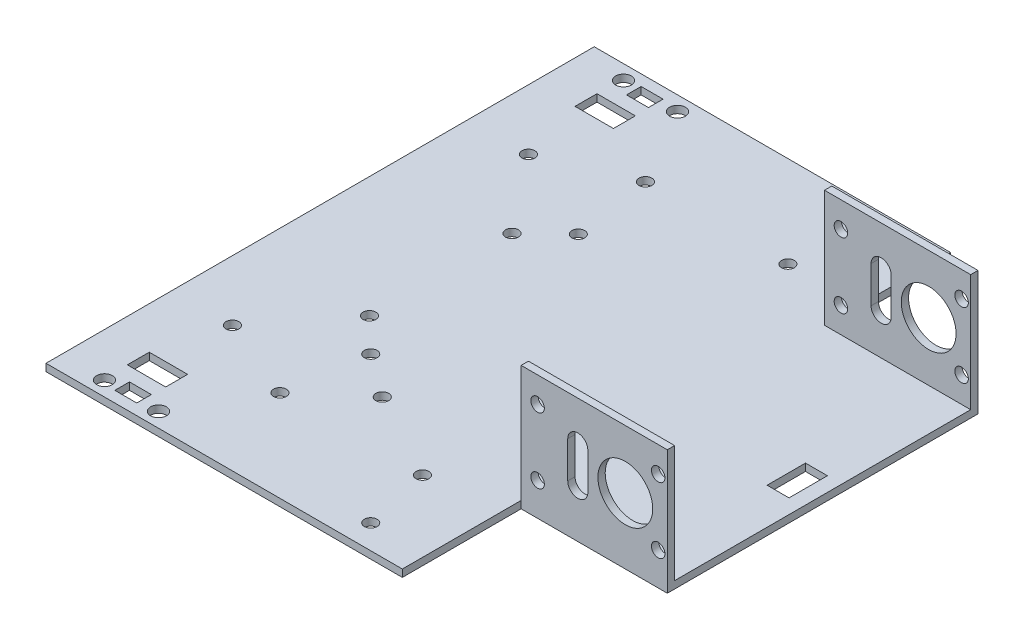
from build123d import *

# Parameters (mm, degrees)
SKETCH1_R           = 2.15
SKETCH1_R_2         = 1.75
SKETCH1_W           = 10.5
SKETCH1_H           = 6
SKETCH1_W_2         = 6
SKETCH1_H_2         = 4
SKETCH1_H_3         = 10.5
BOSS_EXTRUDE1_DEPTH = 2
SKETCH2_W           = 40
SKETCH2_H           = 2
BOSS_EXTRUDE2_DEPTH = 34
SKETCH4_R           = 1.85
SKETCH4_R_2         = 7.5
CUT_EXTRUDE2_DEPTH  = 120
SKETCH5_W           = 4.5
SKETCH5_H           = 32.5
CUT_EXTRUDE3_DEPTH  = 120


with BuildPart() as part:
    # Sketch1 → Boss-Extrude1 (new body)
    with BuildSketch(Plane(origin=(0, 0, 0), x_dir=(1, 0, 0), z_dir=(0, 1, 0))):
        Polygon((-68.75, -75), (33.25, -75), (33.25, -42.5), (68.75, -42.5), (68.75, 42.5), (33.25, 42.5), (33.25, 75), (-68.75, 75), align=None)
        with Locations(Location((-56.75, -71, 0), (0, 0, 270))):
            Circle(SKETCH1_R, mode=Mode.SUBTRACT)
        with Locations(Location((-41.97, -71, 0), (0, 0, 270))):
            Circle(SKETCH1_R, mode=Mode.SUBTRACT)
        with Locations(Location((-52.25, -40.5, 0), (0, 0, 270))):
            Circle(SKETCH1_R_2, mode=Mode.SUBTRACT)
        with Locations(Location((-29.75, -50, 0), (0, 0, 270))):
            Circle(SKETCH1_R_2, mode=Mode.SUBTRACT)
        with Locations(Location((-35.75, -19.5, 0), (0, 0, 270))):
            Circle(SKETCH1_R_2, mode=Mode.SUBTRACT)
        with Locations(Location((-26.5, -28.4, 0), (0, 0, 270))):
            Circle(SKETCH1_R_2, mode=Mode.SUBTRACT)
        with Locations(Location((-14.75, -37, 0), (0, 0, 270))):
            Circle(SKETCH1_R_2, mode=Mode.SUBTRACT)
        with Locations(Location((9.25, -50, 0), (0, 0, 270))):
            Circle(SKETCH1_R_2, mode=Mode.SUBTRACT)
        with Locations(Location((13.5, -68.4, 0), (0, 0, 270))):
            Circle(SKETCH1_R_2, mode=Mode.SUBTRACT)
        with Locations(Location((-52.25, 40.5, 0), (0, 0, 270))):
            Circle(SKETCH1_R_2, mode=Mode.SUBTRACT)
        with Locations(Location((-35.75, 19.5, 0), (0, 0, 270))):
            Circle(SKETCH1_R_2, mode=Mode.SUBTRACT)
        with Locations(Location((-56.75, 71, 0), (0, 0, 270))):
            Circle(SKETCH1_R, mode=Mode.SUBTRACT)
        with Locations(Location((-41.97, 71, 0), (0, 0, 270))):
            Circle(SKETCH1_R, mode=Mode.SUBTRACT)
        with Locations(Location((-29.75, 50, 0), (0, 0, 270))):
            Circle(SKETCH1_R_2, mode=Mode.SUBTRACT)
        with Locations(Location((-26.5, 28.4, 0), (0, 0, 270))):
            Circle(SKETCH1_R_2, mode=Mode.SUBTRACT)
        with Locations(Location((9.25, 50, 0), (0, 0, 270))):
            Circle(SKETCH1_R_2, mode=Mode.SUBTRACT)
        with Locations(Location((13.5, 68.4, 0), (0, 0, 270))):
            Circle(SKETCH1_R_2, mode=Mode.SUBTRACT)
        with Locations((-52, -61.25)):
            Rectangle(SKETCH1_W, SKETCH1_H, mode=Mode.SUBTRACT)
        with Locations((-49.92, -70)):
            Rectangle(SKETCH1_W_2, SKETCH1_H_2, mode=Mode.SUBTRACT)
        with Locations((-52, 61.25)):
            Rectangle(SKETCH1_W, SKETCH1_H, mode=Mode.SUBTRACT)
        with Locations((-49.92, 70)):
            Rectangle(SKETCH1_W_2, SKETCH1_H_2, mode=Mode.SUBTRACT)
        with Locations((61.796244223, 0)):
            Rectangle(SKETCH1_W_2, SKETCH1_H_3, mode=Mode.SUBTRACT)
    extrude(amount=BOSS_EXTRUDE1_DEPTH)

    # Sketch2 → Boss-Extrude2 (add)
    with BuildSketch(Plane(origin=(0, 0, 0), x_dir=(-1, 0, 0), z_dir=(0, -1, 0))):
        with Locations((-48.75, 41.5)):
            Rectangle(SKETCH2_W, SKETCH2_H)
        with Locations((-48.75, -41.5)):
            Rectangle(SKETCH2_W, SKETCH2_H)
    extrude(amount=-BOSS_EXTRUDE2_DEPTH)

    # Sketch4 → Cut-Extrude2 (cut)
    with BuildSketch(Plane(origin=(0, 0, -42.5), x_dir=(-1, 0, 0), z_dir=(0, 0, -1))):
        with Locations((-66.25, 27)):
            Circle(SKETCH4_R)
        with Locations((-33.25, 27)):
            Circle(SKETCH4_R)
        with Locations((-33.25, 9)):
            Circle(SKETCH4_R)
        with Locations((-66.25, 9)):
            Circle(SKETCH4_R)
        with Locations((-57.25, 18)):
            Circle(SKETCH4_R_2)
        with BuildLine():
            Line((-47, 13), (-47, 23))
            ThreePointArc((-47, 23), (-44.25, 25.75), (-41.5, 23))
            Line((-41.5, 23), (-41.5, 13))
            ThreePointArc((-41.5, 13), (-44.25, 10.25), (-47, 13))
        make_face()
    extrude(amount=-CUT_EXTRUDE2_DEPTH, mode=Mode.SUBTRACT)

    # Sketch5 → Cut-Extrude3 (cut)
    with BuildSketch(Plane(origin=(0, 2, 0), x_dir=(1, 0, 0), z_dir=(0, 1, 0))):
        with Locations((31, -58.75)):
            Rectangle(SKETCH5_W, SKETCH5_H)
        with Locations((31, 58.75)):
            Rectangle(SKETCH5_W, SKETCH5_H)
    extrude(amount=-CUT_EXTRUDE3_DEPTH, mode=Mode.SUBTRACT)


solid = part.part
